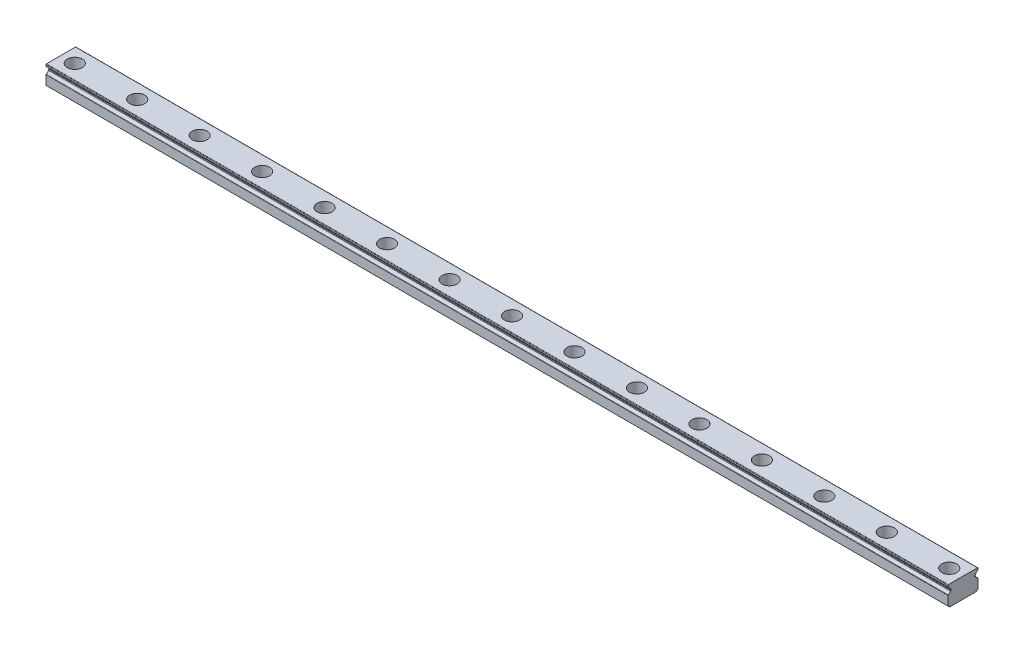
from build123d import *

# Parameters (mm, degrees)
SKETCH_1_W                   = 361
SKETCH_1_H                   = 12
EXTRUDE_1_DEPTH              = 8
CUT_EXTRUDE_1_DEPTH          = 362.072014978
CUT_EXTRUDE_2_DEPTH          = 362.072014978
CUT_EXTRUDE_3_DEPTH          = 362.072014978
CUT_EXTRUDE_4_DEPTH          = 362.072014978
CUT_EXTRUDE_5_DEPTH          = 362.072014978
CUT_EXTRUDE_6_DEPTH          = 362.072014978
HOLE_WIZARD_M3_1_D           = 3.5
HOLE_WIZARD_M3_1_CBORE_D     = 5.9999
HOLE_WIZARD_M3_1_CBORE_DEPTH = 4.5
CHAMFER_1_SIZE               = 0.6
FILLET_1_R                   = 0.2


with BuildPart() as part:
    # 草图1 → 凸台-拉伸1 (new body)
    with BuildSketch(Plane(origin=(0, 4, 0), x_dir=(1, 0, 0), z_dir=(0, 1, 0))):
        Rectangle(SKETCH_1_W, SKETCH_1_H)
    extrude(amount=-EXTRUDE_1_DEPTH)

    # 草图2 → 切除-拉伸1 (cut, through all)
    with BuildSketch(Plane(origin=(180.5, 0, 0), x_dir=(0, 0, -1), z_dir=(1, 0, 0))):
        with BuildLine():
            Line((6, 1.51), (6, 2.01))
            Line((6, 2.01), (4.8, 2.01))
            ThreePointArc((4.8, 2.01), (4.55, 1.76), (4.8, 1.51))
            Line((4.8, 1.51), (6, 1.51))
        make_face()
    extrude(amount=-CUT_EXTRUDE_1_DEPTH, mode=Mode.SUBTRACT)

    # 草图3 → 切除-拉伸2 (cut, through all)
    with BuildSketch(Plane(origin=(180.5, 0, 0), x_dir=(0, 0, -1), z_dir=(1, 0, 0))):
        with BuildLine():
            Line((6, 2.01), (6, 3.111111))
            ThreePointArc((6, 3.111111), (5.367595703, 2.693428684), (5.04, 2.01))
            Line((5.04, 2.01), (6, 2.01))
        make_face()
    extrude(amount=-CUT_EXTRUDE_2_DEPTH, mode=Mode.SUBTRACT)

    # 草图4 → 切除-拉伸3 (cut, through all)
    with BuildSketch(Plane(origin=(180.5, 0, 0), x_dir=(0, 0, -1), z_dir=(1, 0, 0))):
        with BuildLine():
            Line((6, 1.51), (5.04, 1.51))
            ThreePointArc((5.04, 1.51), (5.367595703, 0.826571316), (6, 0.408889))
            Line((6, 0.408889), (6, 1.51))
        make_face()
    extrude(amount=-CUT_EXTRUDE_3_DEPTH, mode=Mode.SUBTRACT)

    # 草图5 → 切除-拉伸4 (cut, through all)
    with BuildSketch(Plane(origin=(180.5, 0, 0), x_dir=(0, 0, -1), z_dir=(1, 0, 0))):
        with BuildLine():
            Line((-6, 2.01), (-6, 1.51))
            Line((-6, 1.51), (-4.8, 1.51))
            ThreePointArc((-4.8, 1.51), (-4.55, 1.76), (-4.8, 2.01))
            Line((-4.8, 2.01), (-6, 2.01))
        make_face()
    extrude(amount=-CUT_EXTRUDE_4_DEPTH, mode=Mode.SUBTRACT)

    # 草图6 → 切除-拉伸5 (cut, through all)
    with BuildSketch(Plane(origin=(180.5, 0, 0), x_dir=(0, 0, -1), z_dir=(1, 0, 0))):
        with BuildLine():
            Line((-6, 1.51), (-6, 0.408889))
            ThreePointArc((-6, 0.408889), (-5.367595703, 0.826571316), (-5.04, 1.51))
            Line((-5.04, 1.51), (-6, 1.51))
        make_face()
    extrude(amount=-CUT_EXTRUDE_5_DEPTH, mode=Mode.SUBTRACT)

    # 草图7 → 切除-拉伸6 (cut, through all)
    with BuildSketch(Plane(origin=(180.5, 0, 0), x_dir=(0, 0, -1), z_dir=(1, 0, 0))):
        with BuildLine():
            Line((-6, 2.01), (-5.04, 2.01))
            ThreePointArc((-5.04, 2.01), (-5.367595703, 2.693428684), (-6, 3.111111))
            Line((-6, 3.111111), (-6, 2.01))
        make_face()
    extrude(amount=-CUT_EXTRUDE_6_DEPTH, mode=Mode.SUBTRACT)

    # M3 六角头机械螺钉的柱形沉头孔1 (through all)
    with Locations(Plane(origin=(0, 4, 0), x_dir=(1, 0, 0), z_dir=(0, 1, 0))):
        with Locations((-175, 0), (-150, 0), (-125, 0), (-100, 0), (-75, 0), (-50, 0), (-25, 0), (0, 0), (25, 0), (50, 0), (75, 0), (100, 0), (125, 0), (150, 0), (175, 0)):
            CounterBoreHole(HOLE_WIZARD_M3_1_D / 2, HOLE_WIZARD_M3_1_CBORE_D / 2, HOLE_WIZARD_M3_1_CBORE_DEPTH)

    # 倒角1
    chamfer_1_edges = [part.edges().sort_by_distance(p)[0] for p in [
        (0, -4, -6),
        (0, -4, 6),
    ]]
    chamfer(chamfer_1_edges, length=CHAMFER_1_SIZE)

    # 圆角1
    fillet_1_edges = [part.edges().sort_by_distance(p)[0] for p in [
        (0, 2.01, -5.04),
        (0, 3.111111, -6),
        (0, 0.408889, -6),
        (0, 1.51, -5.04),
        (0, 4, -6),
        (0, 4, 6),
        (0, 1.51, 5.04),
        (0, 0.408889, 6),
        (0, 3.111111, 6),
        (0, 2.01, 5.04),
    ]]
    fillet(fillet_1_edges, radius=FILLET_1_R)


solid = part.part
